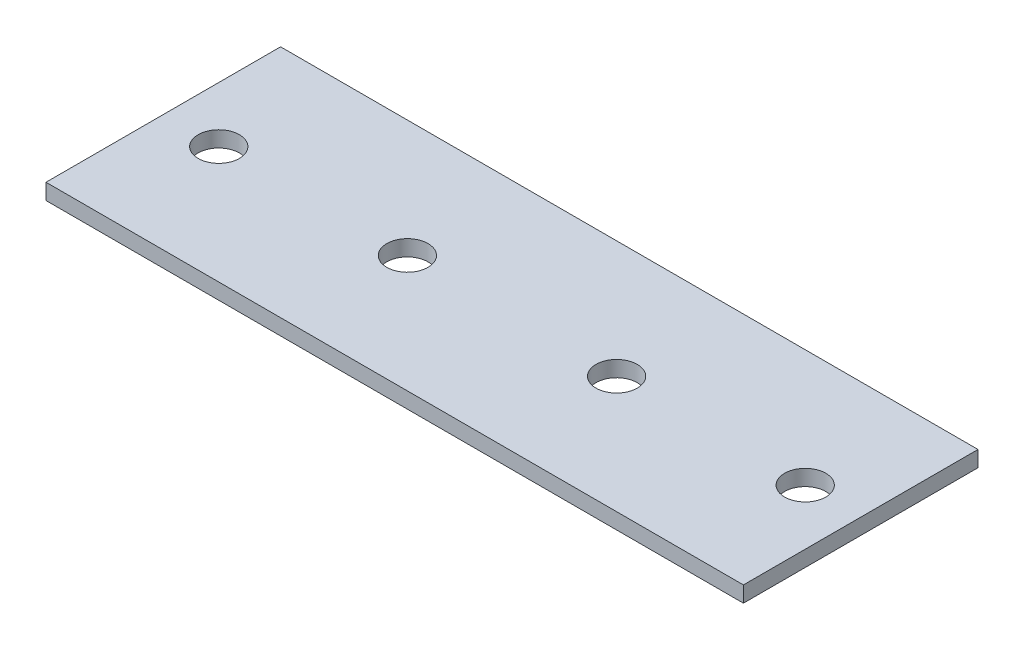
from build123d import *

# Parameters (mm, degrees)
SZKIC1_W                    = 220
SZKIC1_H                    = 74
SZKIC1_R                    = 6.5
DODANIE_WYCI_GNI_CIE1_DEPTH = 5


with BuildPart() as part:
    # Szkic1 → Dodanie-wyciągnięcie1 (new body)
    with BuildSketch(Plane(origin=(0, 0, 0), x_dir=(1, 0, 0), z_dir=(0, 1, 0))):
        with Locations((110, 37)):
            Rectangle(SZKIC1_W, SZKIC1_H)
        with Locations(Location((17.5, 37, 0), (0, 0, 270))):
            Circle(SZKIC1_R, mode=Mode.SUBTRACT)
        with Locations(Location((77, 37, 0), (0, 0, 270))):
            Circle(SZKIC1_R, mode=Mode.SUBTRACT)
        with Locations(Location((202.5, 37, 0), (0, 0, 90))):
            Circle(SZKIC1_R, mode=Mode.SUBTRACT)
        with Locations(Location((143, 37, 0), (0, 0, 90))):
            Circle(SZKIC1_R, mode=Mode.SUBTRACT)
    extrude(amount=DODANIE_WYCI_GNI_CIE1_DEPTH)


solid = part.part
